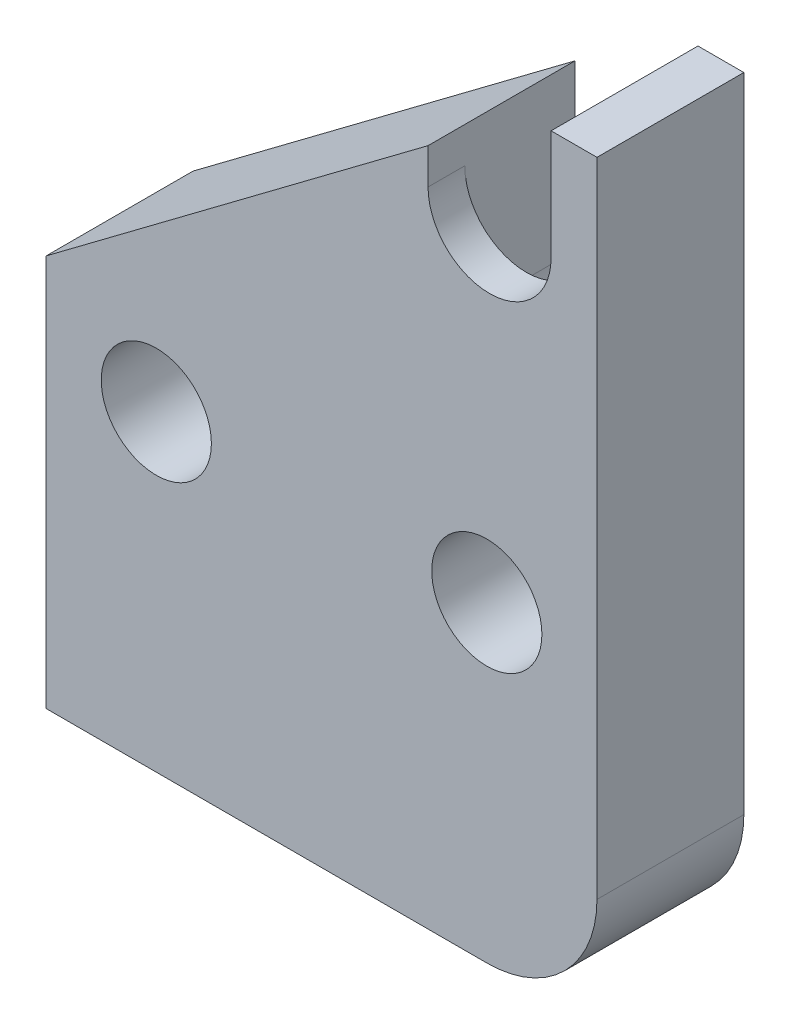
from build123d import *
from build123d.topology import SkipClean

# Parameters (mm, degrees)
EXTRUDE1_DEPTH = 4
EXTRUDE2_DEPTH = 3
SKETCH4_R      = 1.5
EXTRUDE3_DEPTH = 4
FILLET3_R      = 3
EXTRUDE4_DEPTH = 4
EXTRUDE6_DEPTH = 3


with BuildPart() as part:
    # Sketch1 → Extrude1 (new body)
    with BuildSketch(Plane.XY):
        Polygon((0, 20.5), (0, 0), (-15, 0), (-15, 10.675), (-1.9, 20.5), align=None)
    extrude(amount=EXTRUDE1_DEPTH)

    # Sketch2 → Extrude2 (cut)
    with BuildSketch(Plane(origin=(0, 0, 0), x_dir=(-1, 0, 0), z_dir=(0, 0, -1))):
        with BuildLine():
            Line((0.4, 14), (0.4, 21.525360588))
            Line((0.4, 21.525360588), (4.6, 21.525360588))
            Line((4.6, 21.525360588), (4.6, 14))
            ThreePointArc((4.6, 14), (2.5, 11.9), (0.4, 14))
        make_face()
    extrude(amount=-EXTRUDE2_DEPTH, mode=Mode.SUBTRACT)

    # Sketch4 → Extrude3 (cut)
    with BuildSketch(Plane.XY.offset(4)):
        with Locations((-3, 8.5)):
            Circle(SKETCH4_R)
        with Locations((-12, 8.5)):
            Circle(SKETCH4_R)
    extrude(amount=-EXTRUDE3_DEPTH, mode=Mode.SUBTRACT)

    # Fillet3
    fillet3_edges = [part.edges().sort_by_distance(p)[0] for p in [
        (0, 0, 2),
    ]]
    fillet(fillet3_edges, radius=FILLET3_R)

    # Sketch5 → Extrude4 (cut)
    with BuildSketch(Plane.XY.offset(4)):
        with BuildLine():
            Line((-1.25, 23.386660478), (-1.25, 17.5))
            ThreePointArc((-1.25, 17.5), (-2.925, 15.825), (-4.6, 17.5))
            Line((-4.6, 17.5), (-4.6, 23.386660478))
            Line((-4.6, 23.386660478), (-1.25, 23.386660478))
        make_face()
    extrude(amount=-EXTRUDE4_DEPTH, mode=Mode.SUBTRACT)

    # Sketch8 → Extrude6 (add)
    with SkipClean():  # the faces are left unmerged after this step: merging them gives an invalid solid
        with BuildSketch(Plane(origin=(0, 0, 0), x_dir=(-1, 0, 0), z_dir=(0, 0, -1))):
            with BuildLine():
                Line((0.4, 20.5), (1.25, 20.5))
                Line((1.25, 20.5), (1.25, 15.687453703))
                ThreePointArc((1.25, 15.687453703), (0.624500067, 14.944722181), (0.4, 14))
                Line((0.4, 14), (0.4, 20.5))
            make_face()
        extrude(amount=-EXTRUDE6_DEPTH)


solid = part.part
